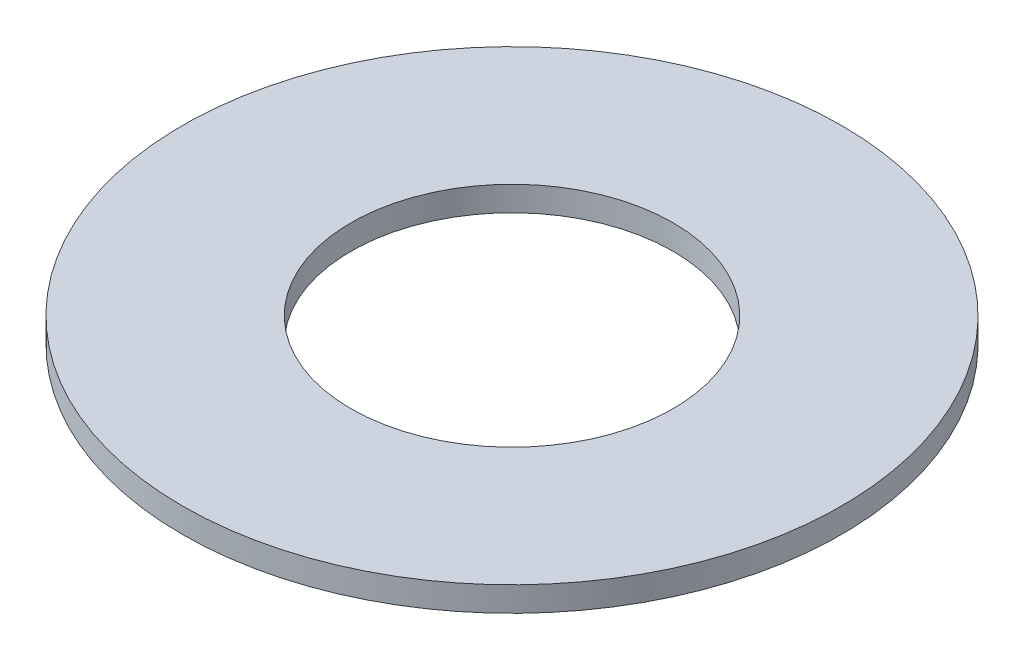
from build123d import *

# Parameters (mm, degrees)
SKETCH1_R               = 60
BOSS_EXTRUDE1_DEPTH     = 4.5
CUT_EXTRUDE1_DEPTH      = 85.97205423
CUT_EXTRUDE1_DEPTH_BACK = 85.97205423
SKETCH2_R               = 29.325


with BuildPart() as part:
    # Sketch1 → Boss-Extrude1 (new body)
    with BuildSketch(Plane(origin=(0, 0, 0), x_dir=(1, 0, 0), z_dir=(0, 1, 0))):
        with Locations(Location((0, 0, 0), (0, 0, 270))):
            Circle(SKETCH1_R)
    extrude(amount=BOSS_EXTRUDE1_DEPTH)

    # Sketch2 → Cut-Extrude1 (cut, two sides: drawn at the far end of the back side and taken through both)
    with BuildSketch(Plane(origin=(0, 4.5, 0), x_dir=(1, 0, 0), z_dir=(0, 1, 0)).offset(-CUT_EXTRUDE1_DEPTH_BACK)):
        with Locations(Location((0, 0, 0), (0, 0, 270))):
            Circle(SKETCH2_R)
    extrude(amount=CUT_EXTRUDE1_DEPTH + CUT_EXTRUDE1_DEPTH_BACK, mode=Mode.SUBTRACT)


solid = part.part
